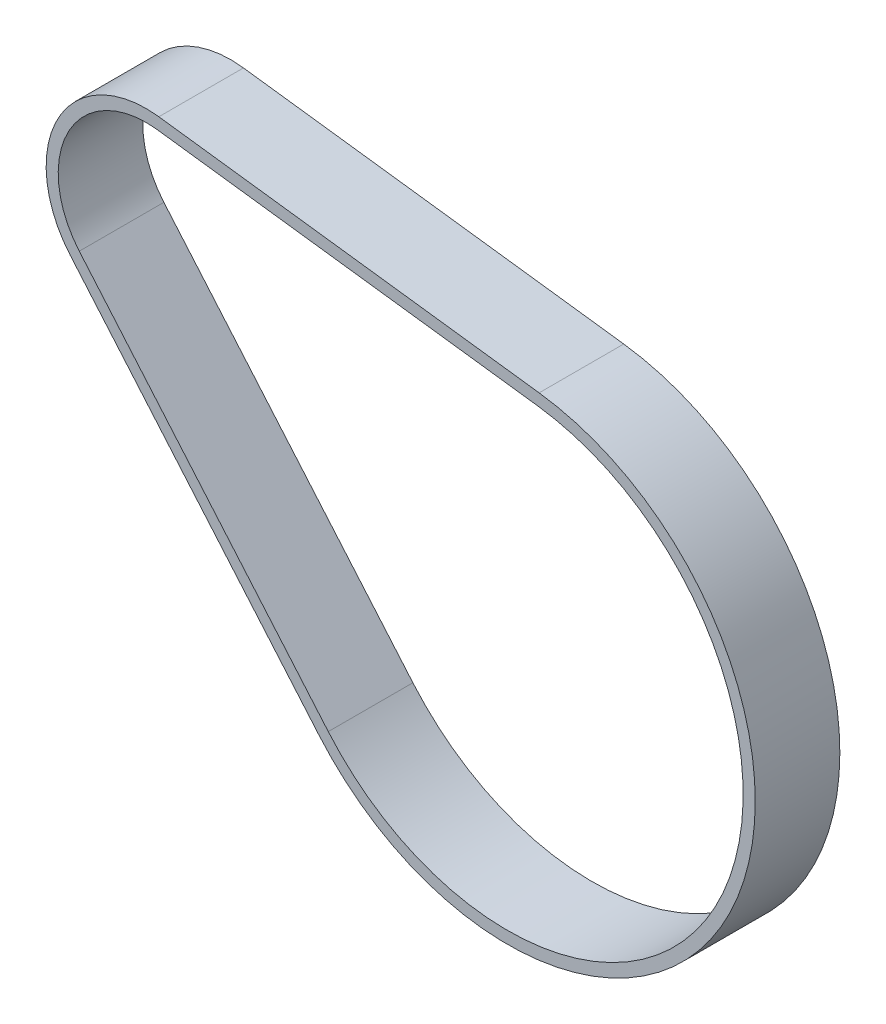
from build123d import *

# Parameters (mm, degrees)
BOSS_EXTRUDE1_DEPTH = 7


with BuildPart() as part:
    # Sketch1 → Boss-Extrude1 (new body)
    with BuildSketch(Plane.XY):
        with BuildLine():
            Line((-28.84670785, 24.383284156), (2.617804957, 20.332169024))
            ThreePointArc((2.617804957, 20.332169024), (17.738884876, 10.27530843), (18.939530416, -7.845010363))
            ThreePointArc((18.939530416, -7.845010363), (3.206757045, -20.247634658), (-15.588518883, -13.313454812))
            Line((-15.588518883, -13.313454812), (-36.191405321, 10.810147126))
            ThreePointArc((-36.191405321, 10.810147126), (-37.176177413, 20.116777399), (-28.84670785, 24.383284156))
        make_face()
        with BuildLine():
            ThreePointArc((-28.974405652, 23.391471033), (-36.296684217, 19.64086594), (-35.430989766, 11.459583946))
            Line((-35.430989766, 11.459583946), (-14.828103328, -12.664017991))
            ThreePointArc((-14.828103328, -12.664017991), (3.050329872, -19.259945163), (18.015650884, -7.462326931))
            ThreePointArc((18.015650884, -7.462326931), (16.873573419, 9.774073873), (2.490107155, 19.340355901))
            Line((2.490107155, 19.340355901), (-28.974405652, 23.391471033))
        make_face(mode=Mode.SUBTRACT)
    extrude(amount=-BOSS_EXTRUDE1_DEPTH)


solid = part.part
